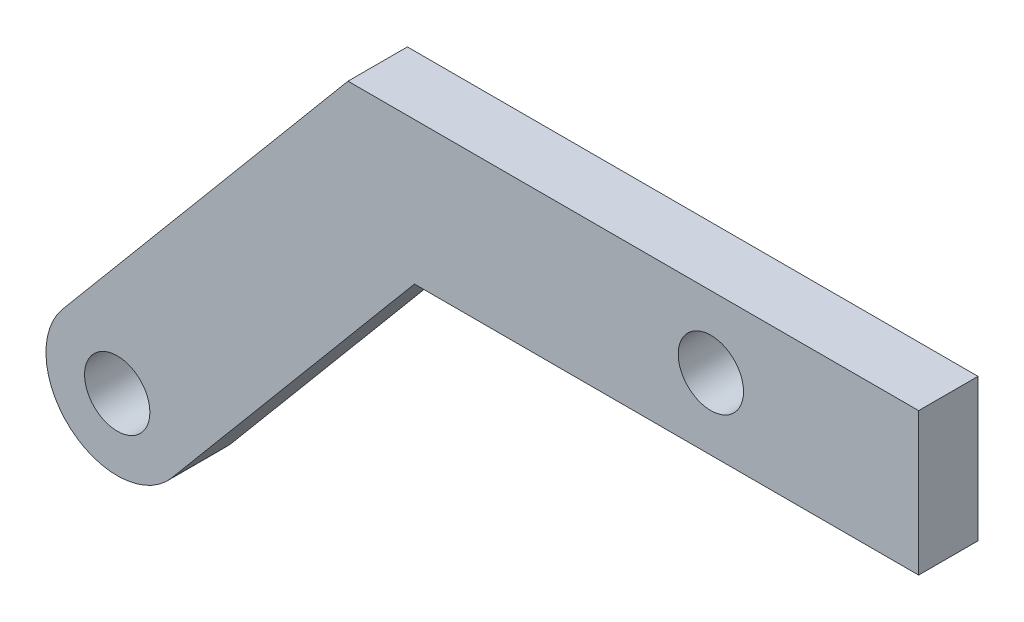
from build123d import *

# Parameters (mm, degrees)
SKETCH1_R           = 5.5
BOSS_EXTRUDE1_DEPTH = 10


with BuildPart() as part:
    # Sketch1 → Boss-Extrude1 (new body)
    with BuildSketch(Plane.XY):
        with BuildLine():
            Line((9.192533317, -7.713451316), (50.06797235, 41))
            Line((50.06797235, 41), (135, 41))
            Line((135, 41), (135, 65))
            Line((135, 65), (38.876588555, 65))
            Line((38.876588555, 65), (-9.192533317, 7.713451316))
            ThreePointArc((-9.192533317, 7.713451316), (-7.713451316, -9.192533317), (9.192533317, -7.713451316))
        make_face()
        with Locations((100, 53)):
            Circle(SKETCH1_R, mode=Mode.SUBTRACT)
        Circle(SKETCH1_R, mode=Mode.SUBTRACT)
    extrude(amount=BOSS_EXTRUDE1_DEPTH)


solid = part.part
